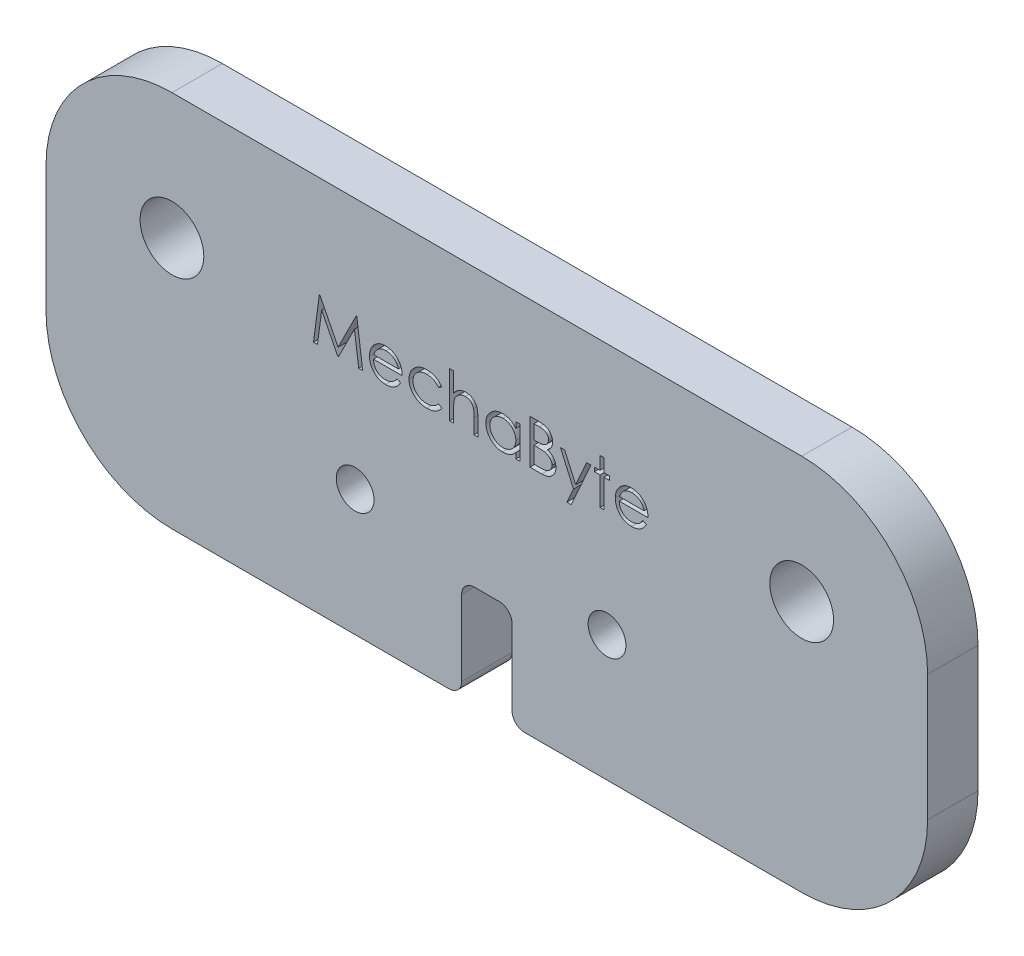
from build123d import *

# Parameters (mm, degrees)
SKETCH1_R           = 1.5
SKETCH1_R_2         = 2.53
BOSS_EXTRUDE1_DEPTH = 4
CUT_EXTRUDE1_DEPTH  = 77.26270386


with BuildPart() as part:
    # Sketch1 → Boss-Extrude1 (new body)
    with BuildSketch(Plane.XY):
        with BuildLine():
            Line((-37, 1), (-37, 7))
            ThreePointArc((-37, 7), (-36.707106781, 7.707106781), (-36, 8))
            Line((-36, 8), (-34, 8))
            ThreePointArc((-34, 8), (-33.292893219, 7.707106781), (-33, 7))
            Line((-33, 7), (-33, 1))
            ThreePointArc((-33, 1), (-32.707106781, 0.292893219), (-32, 0))
            Line((-32, 0), (-10, 0))
            ThreePointArc((-10, 0), (-2.928932188, 2.928932188), (0, 10))
            Line((0, 10), (0, 20))
            ThreePointArc((0, 20), (-2.928932188, 27.071067812), (-10, 30))
            Line((-10, 30), (-60, 30))
            ThreePointArc((-60, 30), (-67.071067812, 27.071067812), (-70, 20))
            Line((-70, 20), (-70, 10))
            ThreePointArc((-70, 10), (-67.071067812, 2.928932188), (-60, 0))
            Line((-60, 0), (-38, 0))
            ThreePointArc((-38, 0), (-37.292893219, 0.292893219), (-37, 1))
        make_face()
        with Locations((-25.456300864, 10)):
            Circle(SKETCH1_R, mode=Mode.SUBTRACT)
        with Locations((-45.456300864, 10)):
            Circle(SKETCH1_R, mode=Mode.SUBTRACT)
        with Locations((-10, 20)):
            Circle(SKETCH1_R_2, mode=Mode.SUBTRACT)
        with Locations((-60, 20)):
            Circle(SKETCH1_R_2, mode=Mode.SUBTRACT)
    extrude(amount=BOSS_EXTRUDE1_DEPTH)

    # Sketch2 → Cut-Extrude1 (cut, through all)
    # profile 1 of 9: a face of its own
    with BuildSketch(Plane.XY.offset(4)):
        Polygon((-48.761506491, 18.460965851), (-48.299467228, 21.960965851), (-48.254595433, 21.960965851), (-46.809583414, 19.089170979), (-45.368778125, 21.960965851), (-45.323906331, 21.960965851), (-44.857660337, 18.460965851), (-45.171762901, 18.460965851), (-45.508301363, 20.977291973), (-46.771021715, 18.460965851), (-46.842536138, 18.460965851), (-48.110865465, 20.985004312), (-48.445300561, 18.460965851), align=None)
    # profile 2 of 9: a face of its own
    with BuildSketch(Plane.XY.offset(4)):
        with BuildLine():
            Line((-42.130296555, 19.268658159), (-41.851250081, 19.122123703))
            add(Edge.make_bspline(
                [(-41.851250081, 19.122123703), (-41.873486676, 19.082680372), (-41.916750284, 19.005939269), (-41.991151032, 18.900507409), (-42.069143105, 18.805659693), (-42.154247073, 18.723930039), (-42.243916752, 18.652678654), (-42.338649406, 18.590340829), (-42.438938224, 18.537222309), (-42.544787949, 18.492469781), (-42.6570875, 18.458060287), (-42.776109017, 18.433756066), (-42.902080512, 18.418732797), (-42.988426692, 18.416987656), (-43.032640305, 18.416094056)],
                knots=[0, 0, 0, 0, 1.120438281, 2.179929193, 3.190490725, 4.156257408, 5.095198341, 6.022838206, 6.959905092, 7.901321166, 8.864066838, 9.862729781, 10.905609505, 12, 12, 12, 12], degree=3))
            add(Edge.make_bspline(
                [(-43.032640305, 18.416094056), (-43.081782282, 18.417241231), (-43.177644044, 18.419479038), (-43.317183791, 18.438771503), (-43.44856321, 18.470243861), (-43.571774913, 18.514209403), (-43.686517166, 18.571636727), (-43.79301802, 18.641596209), (-43.891837546, 18.723728463), (-43.979861755, 18.818744907), (-44.059105638, 18.920426864), (-44.129031458, 19.026382749), (-44.187488889, 19.136345973), (-44.235041499, 19.249616497), (-44.273446364, 19.365480391), (-44.300213068, 19.484991858), (-44.315642816, 19.607827442), (-44.318007262, 19.690924778), (-44.319198798, 19.732800787)],
                knots=[0, 0, 0, 0, 1.145258523, 2.234067595, 3.276747158, 4.290159414, 5.277019952, 6.260822364, 7.254936242, 8.264827045, 9.274100331, 10.257902744, 11.220704747, 12.172965371, 13.118907548, 14.062713208, 15.023725156, 16, 16, 16, 16], degree=3))
            add(Edge.make_bspline(
                [(-44.319198798, 19.732800787), (-44.318139657, 19.772095617), (-44.316040579, 19.849972782), (-44.302809791, 19.965238326), (-44.279361498, 20.077266779), (-44.247185174, 20.186151227), (-44.205633928, 20.291709361), (-44.154801709, 20.394005425), (-44.094609331, 20.492930564), (-44.048136658, 20.555333698), (-44.024727645, 20.586767133)],
                knots=[0, 0, 0, 0, 1.024358464, 2.0301432, 3.019427413, 4.004406732, 4.986367066, 5.972626655, 6.978780325, 8, 8, 8, 8], degree=3))
            add(Edge.make_bspline(
                [(-44.024727645, 20.586767133), (-43.993019962, 20.624636003), (-43.930609015, 20.699174154), (-43.82505266, 20.797112479), (-43.710752464, 20.879156254), (-43.589140837, 20.947163391), (-43.458804363, 20.998837038), (-43.321495072, 21.03734462), (-43.175649486, 21.058922631), (-43.075944265, 21.061970465), (-43.024927965, 21.063529953)],
                knots=[0, 0, 0, 0, 1.030682036, 2.02871468, 2.997146059, 3.962720338, 4.930598197, 5.918074684, 6.934738563, 8, 8, 8, 8], degree=3))
            add(Edge.make_bspline(
                [(-43.024927965, 21.063529953), (-42.97248036, 21.062175905), (-42.869590114, 21.059519569), (-42.719557993, 21.034893236), (-42.577597276, 20.995840681), (-42.443764772, 20.940686891), (-42.318046911, 20.869527339), (-42.201260862, 20.781385498), (-42.091409349, 20.67896741), (-42.02750077, 20.600204201), (-41.994980048, 20.560124505)],
                knots=[0, 0, 0, 0, 1.056321875, 2.072262726, 3.055038591, 4.01806755, 4.982017516, 5.957941055, 6.960871419, 8, 8, 8, 8], degree=3))
            add(Edge.make_bspline(
                [(-41.994980048, 20.560124505), (-41.97285311, 20.529920923), (-41.928746517, 20.469714805), (-41.873499417, 20.371543648), (-41.825542022, 20.268833053), (-41.787209061, 20.159922756), (-41.75616956, 20.046103176), (-41.733712741, 19.926560631), (-41.720543123, 19.80133072), (-41.717954425, 19.716004164), (-41.716634696, 19.672504312)],
                knots=[0, 0, 0, 0, 0.94817472, 1.890038105, 2.849395472, 3.817997239, 4.812318967, 5.836947057, 6.897266129, 8, 8, 8, 8], degree=3))
            Line((-41.716634696, 19.672504312), (-44.005096234, 19.672504312))
            add(Edge.make_bspline(
                [(-44.005096234, 19.672504312), (-44.003556628, 19.638803848), (-44.000529054, 19.572533244), (-43.986413911, 19.475562461), (-43.964165137, 19.383189119), (-43.932896074, 19.296106077), (-43.895029229, 19.21317595), (-43.848643512, 19.135013913), (-43.793303958, 19.061975983), (-43.731578259, 18.993408845), (-43.662871164, 18.932348084), (-43.590588416, 18.877696308), (-43.513694851, 18.831890711), (-43.432796768, 18.794710821), (-43.348024983, 18.765604505), (-43.259352788, 18.745736685), (-43.166954671, 18.732429578), (-43.103968937, 18.730949912), (-43.071903125, 18.73019662)],
                knots=[0, 0, 0, 0, 1.094153842, 2.151609401, 3.174256925, 4.172055639, 5.149267565, 6.128595816, 7.11444997, 8.118368179, 9.117203808, 10.09244225, 11.054858984, 12.015122123, 12.976791628, 13.957293641, 14.960065497, 16, 16, 16, 16], degree=3))
            add(Edge.make_bspline(
                [(-43.071903125, 18.73019662), (-43.040551978, 18.730804677), (-42.978345287, 18.732011178), (-42.88570443, 18.743743089), (-42.794564902, 18.762713364), (-42.705303919, 18.788603354), (-42.619733073, 18.820180207), (-42.540487523, 18.858283064), (-42.467607307, 18.900432811), (-42.399490341, 18.948642486), (-42.333419347, 19.007650673), (-42.267876861, 19.081286394), (-42.197600208, 19.168373922), (-42.153610615, 19.233919588), (-42.130296555, 19.268658159)],
                knots=[0, 0, 0, 0, 0.99110716, 1.966546729, 2.947904876, 3.932708344, 4.903319531, 5.828989031, 6.710028674, 7.56322171, 8.463672341, 9.504779593, 10.677557249, 12, 12, 12, 12], degree=3))
        make_face()
        with BuildLine():
            add(Edge.make_bspline(
                [(-42.03073726, 19.986606877), (-42.042233885, 20.02826975), (-42.064361186, 20.108457371), (-42.11059755, 20.219498261), (-42.162669091, 20.318186162), (-42.224290823, 20.403765795), (-42.294109548, 20.479769308), (-42.374754731, 20.546187894), (-42.465190624, 20.605605345), (-42.564949765, 20.655757844), (-42.67059155, 20.698447703), (-42.781197742, 20.727072819), (-42.89405553, 20.746682361), (-42.970389816, 20.748508469), (-43.008802164, 20.749427389)],
                knots=[0, 0, 0, 0, 1.154881502, 2.222775134, 3.210006277, 4.132804581, 5.035138423, 5.962687519, 6.919655026, 7.923214229, 8.944639381, 9.960483929, 10.97369054, 12, 12, 12, 12], degree=3))
            add(Edge.make_bspline(
                [(-43.008802164, 20.749427389), (-43.040151602, 20.748815718), (-43.102122851, 20.747606572), (-43.19342392, 20.736136442), (-43.281103619, 20.717176598), (-43.365808906, 20.691211641), (-43.446429775, 20.656603038), (-43.524624543, 20.616019812), (-43.598404939, 20.566478228), (-43.644546234, 20.528719373), (-43.667856651, 20.509643736)],
                knots=[0, 0, 0, 0, 1.04873581, 2.073130211, 3.073294108, 4.04793562, 5.032784715, 6.005352987, 6.992311501, 8, 8, 8, 8], degree=3))
            add(Edge.make_bspline(
                [(-43.667856651, 20.509643736), (-43.684549933, 20.49454942), (-43.718333067, 20.464002204), (-43.763473589, 20.411372997), (-43.806694061, 20.354621435), (-43.846027714, 20.291576311), (-43.882105301, 20.222955532), (-43.915865278, 20.149337896), (-43.94625169, 20.070164766), (-43.9633478, 20.014992327), (-43.97214351, 19.986606877)],
                knots=[0, 0, 0, 0, 0.879870761, 1.780643979, 2.707998968, 3.669668524, 4.684282772, 5.740141944, 6.837334558, 8, 8, 8, 8], degree=3))
            Line((-43.97214351, 19.986606877), (-42.03073726, 19.986606877))
        make_face(mode=Mode.SUBTRACT)
    # profile 3 of 9: a face of its own
    with BuildSketch(Plane.XY.offset(4)):
        with BuildLine():
            Line((-38.575609055, 20.464070819), (-38.838529728, 20.300709441))
            add(Edge.make_bspline(
                [(-38.838529728, 20.300709441), (-38.867359593, 20.336537835), (-38.924106289, 20.407059945), (-39.022645525, 20.498069878), (-39.127656939, 20.57623692), (-39.240934987, 20.639940671), (-39.362320787, 20.689162121), (-39.491335638, 20.723992327), (-39.627961143, 20.74569657), (-39.721626342, 20.748163406), (-39.769619472, 20.749427389)],
                knots=[0, 0, 0, 0, 1.026593902, 2.0206758, 2.988051866, 3.946915611, 4.916868779, 5.907761954, 6.927957743, 8, 8, 8, 8], degree=3))
            add(Edge.make_bspline(
                [(-39.769619472, 20.749427389), (-39.807978428, 20.748370547), (-39.883525351, 20.746289125), (-39.994431505, 20.733278632), (-40.100073858, 20.709636624), (-40.201114567, 20.678485667), (-40.296834985, 20.636735377), (-40.387485904, 20.585925621), (-40.473871394, 20.52687558), (-40.553488135, 20.458465035), (-40.626317142, 20.384066367), (-40.689416056, 20.304312672), (-40.744352989, 20.221592781), (-40.787458946, 20.133841039), (-40.822734116, 20.043064985), (-40.845940836, 19.94755113), (-40.861405532, 19.848523122), (-40.86317486, 19.781004782), (-40.864070593, 19.746823223)],
                knots=[0, 0, 0, 0, 1.112346261, 2.190735716, 3.231507886, 4.247384806, 5.251966152, 6.253067467, 7.256802811, 8.280671706, 9.291813951, 10.270744147, 11.225547591, 12.165006084, 13.100104208, 14.043489273, 15.009504848, 16, 16, 16, 16], degree=3))
            add(Edge.make_bspline(
                [(-40.864070593, 19.746823223), (-40.862291341, 19.702054012), (-40.858756811, 19.613118816), (-40.831055351, 19.481840714), (-40.785710944, 19.354917024), (-40.723653093, 19.233248887), (-40.645175959, 19.120654731), (-40.553003395, 19.019671277), (-40.447084312, 18.932255249), (-40.328351981, 18.859782724), (-40.199594238, 18.801521356), (-40.062204133, 18.760014023), (-39.917304353, 18.734961651), (-39.818097605, 18.731805708), (-39.767516106, 18.73019662)],
                knots=[0, 0, 0, 0, 0.966302908, 1.919585723, 2.883856336, 3.870342332, 4.860282998, 5.839159637, 6.814385684, 7.815993281, 8.834850808, 9.858348828, 10.908058873, 12, 12, 12, 12], degree=3))
            add(Edge.make_bspline(
                [(-39.767516106, 18.73019662), (-39.721160922, 18.731496117), (-39.630060683, 18.734049974), (-39.496893398, 18.755578938), (-39.370113487, 18.790822571), (-39.249725457, 18.839970221), (-39.135949291, 18.903497737), (-39.029520116, 18.981856908), (-38.928320178, 19.072793508), (-38.868823201, 19.14311148), (-38.838529728, 19.178914569)],
                knots=[0, 0, 0, 0, 1.039848629, 2.043578496, 3.018386758, 3.987534228, 4.954977003, 5.934852016, 6.948509513, 8, 8, 8, 8], degree=3))
            Line((-38.838529728, 19.178914569), (-38.575609055, 19.006438607))
            add(Edge.make_bspline(
                [(-38.575609055, 19.006438607), (-38.591196757, 18.98354788), (-38.622320424, 18.937842404), (-38.674348049, 18.873398287), (-38.730467881, 18.813076605), (-38.790460978, 18.756958215), (-38.853543988, 18.703700195), (-38.921871897, 18.655848621), (-38.993241509, 18.610713798), (-39.068490667, 18.570100926), (-39.146841365, 18.533594605), (-39.228183354, 18.502203434), (-39.312163167, 18.475233328), (-39.398879543, 18.453795981), (-39.488503441, 18.436685143), (-39.580803076, 18.425331441), (-39.675746657, 18.41685616), (-39.739918809, 18.416350293), (-39.772423959, 18.416094056)],
                knots=[0, 0, 0, 0, 0.954134338, 1.905101784, 2.851144739, 3.791306361, 4.734911809, 5.6936923, 6.663572882, 7.643865596, 8.638447847, 9.640600242, 10.646758161, 11.676244097, 12.717260333, 13.78922464, 14.880174919, 16, 16, 16, 16], degree=3))
            add(Edge.make_bspline(
                [(-39.772423959, 18.416094056), (-39.822034842, 18.416985336), (-39.919272535, 18.418732251), (-40.061595042, 18.437940726), (-40.197608709, 18.466898342), (-40.327267067, 18.508462076), (-40.450590302, 18.561966852), (-40.56746342, 18.627323766), (-40.677499438, 18.705075556), (-40.779610221, 18.793838325), (-40.873391667, 18.890078966), (-40.953917857, 18.993928884), (-41.023763128, 19.101569932), (-41.079850671, 19.215379458), (-41.124497597, 19.333844831), (-41.15500243, 19.457915071), (-41.174732168, 19.586567325), (-41.177015547, 19.674300207), (-41.178173157, 19.718778351)],
                knots=[0, 0, 0, 0, 1.1129367, 2.181364009, 3.217532258, 4.231199276, 5.232079859, 6.230262199, 7.231623845, 8.250719726, 9.263571943, 10.242672461, 11.195837495, 12.138959767, 13.085126421, 14.0317438, 15.002148558, 16, 16, 16, 16], degree=3))
            add(Edge.make_bspline(
                [(-41.178173157, 19.718778351), (-41.177732141, 19.748956785), (-41.176854887, 19.808986673), (-41.16679296, 19.89808174), (-41.153794487, 19.985990285), (-41.13176875, 20.071598004), (-41.106328118, 20.156203294), (-41.073852586, 20.238786396), (-41.035757191, 20.319731068), (-40.992505244, 20.398828798), (-40.943816499, 20.474778337), (-40.889935266, 20.546532002), (-40.832890929, 20.614951768), (-40.770014817, 20.677675528), (-40.703975164, 20.73721172), (-40.632903588, 20.791969844), (-40.557207736, 20.842110835), (-40.478024414, 20.88856185), (-40.395399702, 20.929921285), (-40.309833032, 20.965554523), (-40.221840003, 20.996007099), (-40.131279859, 21.020116018), (-40.038753685, 21.040333442), (-39.943532347, 21.053051288), (-39.845980125, 21.062037561), (-39.779924102, 21.063028353), (-39.746482452, 21.063529953)],
                knots=[0, 0, 0, 0, 0.990994727, 1.971252077, 2.943264845, 3.907940874, 4.872158414, 5.844625996, 6.82015047, 7.809835459, 8.804511986, 9.781214284, 10.756496977, 11.728388426, 12.696359165, 13.676225489, 14.672885716, 15.677705647, 16.690706858, 17.706033469, 18.721040654, 19.747369689, 20.783475414, 21.830280724, 22.901553713, 24, 24, 24, 24], degree=3))
            add(Edge.make_bspline(
                [(-39.746482452, 21.063529953), (-39.704602344, 21.062608062), (-39.621051465, 21.060768888), (-39.497110758, 21.045290236), (-39.374995564, 21.02195382), (-39.256848461, 20.98738099), (-39.144101946, 20.945517334), (-39.038566496, 20.89850462), (-38.942726392, 20.843910016), (-38.854798803, 20.784189902), (-38.774619286, 20.716828996), (-38.701364793, 20.641022039), (-38.633533144, 20.55716356), (-38.595076432, 20.495357829), (-38.575609055, 20.464070819)],
                knots=[0, 0, 0, 0, 1.095225653, 2.184976855, 3.262915854, 4.344593502, 5.400796181, 6.407717688, 7.363229445, 8.282371371, 9.184954523, 10.097238608, 11.036792983, 12, 12, 12, 12], degree=3))
        make_face()
    # profile 4 of 9: a face of its own
    with BuildSketch(Plane.XY.offset(4)):
        with BuildLine():
            Line((-37.947403927, 22.050709441), (-37.633301363, 22.050709441))
            Line((-37.633301363, 22.050709441), (-37.633301363, 20.535585242))
            add(Edge.make_bspline(
                [(-37.633301363, 20.535585242), (-37.599584061, 20.577729224), (-37.533934747, 20.659785717), (-37.42343863, 20.766846908), (-37.309967758, 20.859645529), (-37.189602948, 20.933515986), (-37.064552428, 20.991872529), (-36.934288784, 21.033260176), (-36.798787812, 21.058711272), (-36.706762662, 21.06190969), (-36.660144311, 21.063529953)],
                knots=[0, 0, 0, 0, 1.125788106, 2.19196713, 3.20547328, 4.180437432, 5.132270164, 6.079753143, 7.027236121, 8, 8, 8, 8], degree=3))
            add(Edge.make_bspline(
                [(-36.660144311, 21.063529953), (-36.612813918, 21.061784523), (-36.520176923, 21.058368295), (-36.38529546, 21.031354914), (-36.259334585, 20.985197476), (-36.142668743, 20.922030451), (-36.037844045, 20.843357624), (-35.944994281, 20.752526101), (-35.869153482, 20.647252183), (-35.817554365, 20.549995929), (-35.783980958, 20.463457175), (-35.762729131, 20.389220663), (-35.744709933, 20.30649875), (-35.729010197, 20.215334017), (-35.718546616, 20.115288846), (-35.710141998, 20.006814591), (-35.704165543, 19.889917473), (-35.703933939, 19.808997224), (-35.703814183, 19.767155755)],
                knots=[0, 0, 0, 0, 1.235656852, 2.418478516, 3.575258207, 4.727955599, 5.870717718, 6.98870536, 8.107142894, 9.245821548, 9.854588956, 10.528768408, 11.260415777, 12.065282286, 12.943670737, 13.886611085, 14.907229059, 16, 16, 16, 16], degree=3))
            Line((-35.703814183, 19.767155755), (-35.703814183, 18.460965851))
            Line((-35.703814183, 18.460965851), (-36.017916747, 18.460965851))
            Line((-36.017916747, 18.460965851), (-36.017916747, 19.664090851))
            add(Edge.make_bspline(
                [(-36.017916747, 19.664090851), (-36.01810705, 19.69891352), (-36.018471068, 19.765523361), (-36.019674412, 19.860889469), (-36.022360628, 19.947385604), (-36.026701454, 20.024734556), (-36.031266761, 20.093044159), (-36.037550078, 20.152215213), (-36.044860312, 20.202328989), (-36.051429094, 20.232493617), (-36.054375081, 20.246021941)],
                knots=[0, 0, 0, 0, 1.430932559, 2.737130458, 3.918967929, 4.986496826, 5.920444988, 6.731744033, 7.431208747, 8, 8, 8, 8], degree=3))
            add(Edge.make_bspline(
                [(-36.054375081, 20.246021941), (-36.065799326, 20.285716204), (-36.08776237, 20.362028195), (-36.138810347, 20.465690605), (-36.202569359, 20.554075346), (-36.28041662, 20.625989634), (-36.370974984, 20.682401173), (-36.474834948, 20.721468956), (-36.591019017, 20.745716677), (-36.672870489, 20.748155981), (-36.715532933, 20.749427389)],
                knots=[0, 0, 0, 0, 1.090059168, 2.095632401, 3.037101401, 3.955032261, 4.878929692, 5.839099886, 6.873700383, 8, 8, 8, 8], degree=3))
            add(Edge.make_bspline(
                [(-36.715532933, 20.749427389), (-36.740800706, 20.748951563), (-36.790804977, 20.748009915), (-36.864953642, 20.738556017), (-36.936882706, 20.723107298), (-37.007284884, 20.702202759), (-37.074668081, 20.673757223), (-37.140996406, 20.640827033), (-37.204390615, 20.600518778), (-37.265976432, 20.555293011), (-37.323293966, 20.505223251), (-37.376621081, 20.452376296), (-37.424159421, 20.396101332), (-37.467228012, 20.337301216), (-37.504406298, 20.275169423), (-37.53685938, 20.210305104), (-37.564395076, 20.142622958), (-37.578077769, 20.095647897), (-37.584923959, 20.072143736)],
                knots=[0, 0, 0, 0, 1.024319606, 2.027102035, 3.025350316, 4.005802111, 5.00026367, 5.987881639, 7.005602596, 8.042517216, 9.083927026, 10.089214625, 11.084353441, 12.06828073, 13.041928858, 14.016821737, 15.00770877, 16, 16, 16, 16], degree=3))
            add(Edge.make_bspline(
                [(-37.584923959, 20.072143736), (-37.588863386, 20.055122785), (-37.597447883, 20.018032038), (-37.606762716, 19.956857714), (-37.615100513, 19.885771342), (-37.622149062, 19.804880741), (-37.626472149, 19.713889499), (-37.63113039, 19.61341854), (-37.632864404, 19.502838519), (-37.633151357, 19.425943012), (-37.633301363, 19.385745498)],
                knots=[0, 0, 0, 0, 0.607992626, 1.324890765, 2.152360218, 3.099583803, 4.150613268, 5.323148443, 6.60066238, 8, 8, 8, 8], degree=3))
            Line((-37.633301363, 19.385745498), (-37.633301363, 18.460965851))
            Line((-37.633301363, 18.460965851), (-37.947403927, 18.460965851))
            Line((-37.947403927, 18.460965851), (-37.947403927, 22.050709441))
        make_face()
    # profile 5 of 9: a face of its own
    with BuildSketch(Plane.XY.offset(4)):
        with BuildLine():
            Line((-32.383301363, 21.018658159), (-32.383301363, 18.460965851))
            Line((-32.383301363, 18.460965851), (-32.697403927, 18.460965851))
            Line((-32.697403927, 18.460965851), (-32.697403927, 18.903373703))
            add(Edge.make_bspline(
                [(-32.697403927, 18.903373703), (-32.732822717, 18.86333411), (-32.801942933, 18.785196338), (-32.917384051, 18.683114166), (-33.039752228, 18.598735844), (-33.16845355, 18.530585929), (-33.303371793, 18.479393872), (-33.44420788, 18.443007713), (-33.591019261, 18.419613878), (-33.691271616, 18.417277856), (-33.742075401, 18.416094056)],
                knots=[0, 0, 0, 0, 1.074387032, 2.096679803, 3.090159297, 4.057316773, 5.018401886, 5.985159533, 6.978961417, 8, 8, 8, 8], degree=3))
            add(Edge.make_bspline(
                [(-33.742075401, 18.416094056), (-33.787243355, 18.417320428), (-33.87631656, 18.419738889), (-34.007345637, 18.438501192), (-34.133437886, 18.468631814), (-34.254712459, 18.510532704), (-34.370384604, 18.566113525), (-34.481444701, 18.632654773), (-34.587317393, 18.711895603), (-34.686388932, 18.802483632), (-34.777620932, 18.900878619), (-34.857682205, 19.005824166), (-34.924435285, 19.11686647), (-34.980255366, 19.232599623), (-35.02325171, 19.353914543), (-35.053225344, 19.480391711), (-35.071965791, 19.611881584), (-35.074383252, 19.701421108), (-35.075609055, 19.746823223)],
                knots=[0, 0, 0, 0, 1.033919861, 2.038935746, 3.024066025, 3.998881131, 4.97069526, 5.957263378, 6.95902576, 7.993208707, 9.027059324, 10.027763471, 11.009749337, 11.988697705, 12.965288445, 13.950418724, 14.960734635, 16, 16, 16, 16], degree=3))
            add(Edge.make_bspline(
                [(-35.075609055, 19.746823223), (-35.074356083, 19.791286926), (-35.071879027, 19.87918927), (-35.053425807, 20.008467968), (-35.022394798, 20.132986228), (-34.97884695, 20.252343172), (-34.923004996, 20.366683222), (-34.855076909, 20.476087247), (-34.775057784, 20.580856644), (-34.682805377, 20.678527871), (-34.582870607, 20.768748485), (-34.475961876, 20.847157531), (-34.364738594, 20.91487438), (-34.247475584, 20.968527856), (-34.125908479, 21.01193696), (-33.998955033, 21.041969928), (-33.867143455, 21.05966725), (-33.777652963, 21.062230014), (-33.732259696, 21.063529953)],
                knots=[0, 0, 0, 0, 1.020392517, 2.01726096, 2.990465484, 3.961182959, 4.928053699, 5.906110375, 6.912531644, 7.948652711, 8.985773172, 9.998621852, 10.987621588, 11.969261332, 12.953316658, 13.946091881, 14.958173133, 16, 16, 16, 16], degree=3))
            add(Edge.make_bspline(
                [(-33.732259696, 21.063529953), (-33.680059837, 21.062092202), (-33.577698377, 21.059272839), (-33.427970368, 21.035810112), (-33.28632589, 20.996171645), (-33.151671538, 20.942254147), (-33.024490852, 20.870605417), (-32.905987867, 20.780225456), (-32.794922384, 20.671684269), (-32.730542092, 20.588313825), (-32.697403927, 20.545400947)],
                knots=[0, 0, 0, 0, 1.038897134, 2.037228247, 3.008116434, 3.962042015, 4.918381754, 5.904844433, 6.921570401, 8, 8, 8, 8], degree=3))
            Line((-32.697403927, 20.545400947), (-32.697403927, 21.018658159))
            Line((-32.697403927, 21.018658159), (-32.383301363, 21.018658159))
        make_face()
        with BuildLine():
            add(Edge.make_bspline(
                [(-33.728052965, 20.749427389), (-33.773967303, 20.747793752), (-33.864594903, 20.744569211), (-33.997638905, 20.719395715), (-34.124952319, 20.677511121), (-34.245898393, 20.62022922), (-34.35856661, 20.548200483), (-34.459260281, 20.4610791), (-34.548802982, 20.361242086), (-34.624111246, 20.249139975), (-34.685501743, 20.128961884), (-34.728668775, 20.003337446), (-34.757138023, 19.874532469), (-34.760046543, 19.787169783), (-34.761506491, 19.743317614)],
                knots=[0, 0, 0, 0, 1.031046209, 2.035121221, 3.029706178, 4.034933723, 5.034054252, 6.02443088, 7.017295772, 8.038157696, 9.050218397, 10.03989886, 11.016116709, 12, 12, 12, 12], degree=3))
            add(Edge.make_bspline(
                [(-34.761506491, 19.743317614), (-34.759641597, 19.699727507), (-34.755919121, 19.612718151), (-34.729168426, 19.483737574), (-34.684288553, 19.358083532), (-34.62304649, 19.236822538), (-34.546359865, 19.124238438), (-34.457471213, 19.022498315), (-34.355520931, 18.935008727), (-34.242593424, 18.861771154), (-34.121985454, 18.802608633), (-33.995151523, 18.761442993), (-33.864475884, 18.734865213), (-33.77562355, 18.731760736), (-33.730857452, 18.73019662)],
                knots=[0, 0, 0, 0, 0.979072187, 1.954306742, 2.945804271, 3.96968567, 4.997920485, 5.998718438, 6.996577872, 8.005894225, 9.015743152, 10.005417472, 10.995077863, 12, 12, 12, 12], degree=3))
            add(Edge.make_bspline(
                [(-33.730857452, 18.73019662), (-33.68541095, 18.731856584), (-33.595022363, 18.735158088), (-33.461583655, 18.760439353), (-33.332088692, 18.802208151), (-33.208301464, 18.860107278), (-33.092985333, 18.931864634), (-32.989487455, 19.015871725), (-32.901971487, 19.113574909), (-32.827778877, 19.220951362), (-32.769603461, 19.338663359), (-32.727227401, 19.463997549), (-32.702173496, 19.596958298), (-32.699015766, 19.687822224), (-32.697403927, 19.73420303)],
                knots=[0, 0, 0, 0, 1.01762866, 2.023962475, 3.030623092, 4.058876274, 5.077231937, 6.066672613, 7.034107872, 8.005628644, 8.981990164, 9.965428785, 10.961468474, 12, 12, 12, 12], degree=3))
            add(Edge.make_bspline(
                [(-32.697403927, 19.73420303), (-32.698363583, 19.769540861), (-32.70025249, 19.839096894), (-32.71468306, 19.941224412), (-32.737637986, 20.038958138), (-32.769984156, 20.132400827), (-32.812475441, 20.221035842), (-32.863723207, 20.305499603), (-32.924628656, 20.385352814), (-32.994211353, 20.459495885), (-33.070376555, 20.527122347), (-33.150971096, 20.587486588), (-33.236949843, 20.637075361), (-33.32686688, 20.678116632), (-33.420878214, 20.710775782), (-33.519748834, 20.732563476), (-33.622427821, 20.747523797), (-33.692473876, 20.748786178), (-33.728052965, 20.749427389)],
                knots=[0, 0, 0, 0, 1.050140795, 2.067009409, 3.05949893, 4.030605086, 5.00011959, 5.97591094, 6.962425594, 7.979863591, 8.993523472, 9.986985069, 10.967611495, 11.937549037, 12.921786183, 13.919465291, 14.943216303, 16, 16, 16, 16], degree=3))
        make_face(mode=Mode.SUBTRACT)
    # profile 6 of 9: a face of its own
    with BuildSketch(Plane.XY.offset(4)):
        with BuildLine():
            Line((-31.575609055, 21.960965851), (-30.892716427, 21.960965851))
            add(Edge.make_bspline(
                [(-30.892716427, 21.960965851), (-30.859287948, 21.960790101), (-30.794495238, 21.960449453), (-30.700275796, 21.955166321), (-30.612026986, 21.947962651), (-30.529723213, 21.936532559), (-30.453402511, 21.922740782), (-30.382834874, 21.906038966), (-30.318244701, 21.886012352), (-30.241131965, 21.854166071), (-30.153211304, 21.806842902), (-30.058012911, 21.736914337), (-29.976608672, 21.651381874), (-29.906422355, 21.554899219), (-29.850621235, 21.448763447), (-29.810251938, 21.335504258), (-29.784694063, 21.216582516), (-29.782065628, 21.134939338), (-29.78073726, 21.093678191)],
                knots=[0, 0, 0, 0, 1.001505555, 1.941167018, 2.826882275, 3.653841531, 4.429895133, 5.150066043, 5.825578002, 6.45369114, 7.647487171, 8.808567382, 9.977351308, 11.170798116, 12.373658725, 13.556498008, 14.765093433, 16, 16, 16, 16], degree=3))
            add(Edge.make_bspline(
                [(-29.78073726, 21.093678191), (-29.781830478, 21.055025635), (-29.783978756, 20.979069718), (-29.804521515, 20.867975609), (-29.836682184, 20.76222439), (-29.881387433, 20.662202004), (-29.939489429, 20.570168391), (-30.008347748, 20.485381125), (-30.09142455, 20.411430068), (-30.15366779, 20.370087166), (-30.185284536, 20.349086845)],
                knots=[0, 0, 0, 0, 1.044552857, 2.05264487, 3.044412934, 4.028983338, 5.005914585, 5.980388656, 6.974128949, 8, 8, 8, 8], degree=3))
            add(Edge.make_bspline(
                [(-30.185284536, 20.349086845), (-30.145524108, 20.333821846), (-30.069452561, 20.304616121), (-29.964766548, 20.252980657), (-29.874571703, 20.196818547), (-29.798174557, 20.135486697), (-29.732836902, 20.069377886), (-29.675783961, 19.997522772), (-29.627102587, 19.918984014), (-29.585389663, 19.834580478), (-29.552840907, 19.74517401), (-29.528465003, 19.651603234), (-29.514497554, 19.554203679), (-29.512509912, 19.487918299), (-29.511506491, 19.454455434)],
                knots=[0, 0, 0, 0, 1.27268992, 2.434971085, 3.483601985, 4.442670788, 5.356604649, 6.2567628, 7.179492994, 8.113709626, 9.066344395, 10.018646069, 10.999752585, 12, 12, 12, 12], degree=3))
            add(Edge.make_bspline(
                [(-29.511506491, 19.454455434), (-29.512483337, 19.420288562), (-29.514405309, 19.353064284), (-29.528585281, 19.254309149), (-29.552594388, 19.159934203), (-29.585665534, 19.06932902), (-29.628827848, 18.982668886), (-29.681355813, 18.899855622), (-29.743987376, 18.821721291), (-29.814050245, 18.747397668), (-29.893312391, 18.680569881), (-29.978828146, 18.621054174), (-30.071674466, 18.572108112), (-30.17032646, 18.53099209), (-30.275890776, 18.499584892), (-30.387893383, 18.477612318), (-30.506237685, 18.462807281), (-30.587447436, 18.461590076), (-30.629094632, 18.460965851)],
                knots=[0, 0, 0, 0, 0.978564426, 1.925352924, 2.850884081, 3.763762016, 4.682927383, 5.618979971, 6.567305752, 7.547517671, 8.540179244, 9.531824382, 10.526200242, 11.540722885, 12.589160233, 13.674978461, 14.80764778, 16, 16, 16, 16], degree=3))
            Line((-30.629094632, 18.460965851), (-31.575609055, 18.460965851))
            Line((-31.575609055, 18.460965851), (-31.575609055, 21.960965851))
        make_face()
        with BuildLine():
            Line((-31.261506491, 21.601991492), (-31.261506491, 20.48019662))
            Line((-31.261506491, 20.48019662), (-31.050468831, 20.48019662))
            add(Edge.make_bspline(
                [(-31.050468831, 20.48019662), (-31.019620035, 20.480596543), (-30.960013876, 20.481369276), (-30.873693979, 20.483582793), (-30.793568961, 20.489780836), (-30.719777128, 20.495977098), (-30.652434684, 20.506051686), (-30.591690823, 20.518043809), (-30.536592226, 20.530726714), (-30.47305268, 20.552296201), (-30.400979732, 20.584173876), (-30.324146628, 20.633645712), (-30.256412158, 20.692570066), (-30.19921497, 20.760561027), (-30.1524035, 20.835427213), (-30.119889785, 20.915974094), (-30.0978425, 21.000194226), (-30.095850969, 21.058012478), (-30.094839824, 21.087368095)],
                knots=[0, 0, 0, 0, 1.156816544, 2.235205308, 3.236616184, 4.169592532, 5.011045266, 5.787822928, 6.49130361, 7.128639758, 8.301311294, 9.436451833, 10.541879658, 11.654887649, 12.756523258, 13.837046038, 14.901820046, 16, 16, 16, 16], degree=3))
            add(Edge.make_bspline(
                [(-30.094839824, 21.087368095), (-30.095366004, 21.106793866), (-30.096398164, 21.144899638), (-30.104851467, 21.200448992), (-30.119219041, 21.252692745), (-30.137673334, 21.302346855), (-30.163462023, 21.347858705), (-30.193825486, 21.390801901), (-30.230511177, 21.42971402), (-30.272268489, 21.466083518), (-30.320277112, 21.498328046), (-30.374508404, 21.526568809), (-30.435696081, 21.549309586), (-30.502808936, 21.569225738), (-30.576880024, 21.583214032), (-30.657054577, 21.594867419), (-30.743989296, 21.600800161), (-30.804134399, 21.601585524), (-30.835224439, 21.601991492)],
                knots=[0, 0, 0, 0, 0.91205012, 1.789085906, 2.630437955, 3.453916878, 4.269457761, 5.079663411, 5.91843418, 6.774407191, 7.675494373, 8.627863946, 9.638891023, 10.736472738, 11.911756761, 13.175263542, 14.539845004, 16, 16, 16, 16], degree=3))
            Line((-30.835224439, 21.601991492), (-31.261506491, 21.601991492))
        make_face(mode=Mode.SUBTRACT)
        with BuildLine():
            Line((-31.261506491, 20.121222261), (-31.261506491, 18.81994021))
            Line((-31.261506491, 18.81994021), (-30.814190786, 18.81994021))
            add(Edge.make_bspline(
                [(-30.814190786, 18.81994021), (-30.78217186, 18.820323957), (-30.720459601, 18.82106358), (-30.631358371, 18.823478134), (-30.548775267, 18.82897041), (-30.473087132, 18.83761626), (-30.403476679, 18.846994709), (-30.340778976, 18.85960599), (-30.284485782, 18.87405495), (-30.219211475, 18.896389123), (-30.145707966, 18.931085594), (-30.06649711, 18.98339982), (-29.996070892, 19.045723128), (-29.936265633, 19.117854042), (-29.887252644, 19.196285369), (-29.851597189, 19.279430719), (-29.829606332, 19.365916246), (-29.826944163, 19.424882959), (-29.825609055, 19.454455434)],
                knots=[0, 0, 0, 0, 1.160039823, 2.235823828, 3.228722157, 4.157150951, 4.99529583, 5.772374946, 6.472645482, 7.099169577, 8.269452708, 9.405989375, 10.527446681, 11.663510218, 12.788923519, 13.866172445, 14.929861265, 16, 16, 16, 16], degree=3))
            add(Edge.make_bspline(
                [(-29.825609055, 19.454455434), (-29.825885159, 19.472948775), (-29.826432914, 19.509637157), (-29.834693529, 19.563552976), (-29.846707399, 19.615778849), (-29.862238833, 19.66645659), (-29.8848583, 19.714669966), (-29.911264845, 19.761372525), (-29.942226247, 19.806626005), (-29.990470413, 19.863838258), (-30.060642397, 19.929755271), (-30.160349172, 19.994292773), (-30.27372147, 20.046340581), (-30.355948963, 20.068440057), (-30.398425561, 20.079856075)],
                knots=[0, 0, 0, 0, 0.723448775, 1.435228256, 2.130040452, 2.821711965, 3.505591119, 4.210454504, 4.921174351, 5.648778258, 7.137944449, 8.670945889, 10.280296675, 12, 12, 12, 12], degree=3))
            add(Edge.make_bspline(
                [(-30.398425561, 20.079856075), (-30.415454657, 20.083311159), (-30.452377249, 20.090802494), (-30.51258483, 20.098710197), (-30.581320699, 20.105755257), (-30.658743576, 20.110966415), (-30.744951417, 20.116352958), (-30.840128336, 20.11844778), (-30.943885651, 20.12094704), (-31.015878023, 20.121128174), (-31.053273318, 20.121222261)],
                knots=[0, 0, 0, 0, 0.634451884, 1.375622551, 2.216452059, 3.157844607, 4.20941857, 5.370758133, 6.634282058, 8, 8, 8, 8], degree=3))
            Line((-31.053273318, 20.121222261), (-31.261506491, 20.121222261))
        make_face(mode=Mode.SUBTRACT)
    # profile 7 of 9: a face of its own
    with BuildSketch(Plane.XY.offset(4)):
        Polygon((-29.152532132, 21.018658159), (-28.814591427, 21.018658159), (-27.947303766, 19.059723864), (-27.068798157, 21.018658159), (-26.729455209, 21.018658159), (-28.299968029, 17.518658159), (-28.639310978, 17.518658159), (-28.116975241, 18.680416973), align=None)
    # profile 8 of 9: a face of its own
    with BuildSketch(Plane.XY.offset(4)):
        Polygon((-26.011506491, 22.050709441), (-25.697403927, 22.050709441), (-25.697403927, 21.018658159), (-25.248685978, 21.018658159), (-25.248685978, 20.704555595), (-25.697403927, 20.704555595), (-25.697403927, 18.460965851), (-26.011506491, 18.460965851), (-26.011506491, 20.704555595), (-26.460224439, 20.704555595), (-26.460224439, 21.018658159), (-26.011506491, 21.018658159), align=None)
    # profile 9 of 9: a face of its own
    with BuildSketch(Plane.XY.offset(4)):
        with BuildLine():
            Line((-22.611065786, 19.268658159), (-22.332019311, 19.122123703))
            add(Edge.make_bspline(
                [(-22.332019311, 19.122123703), (-22.354255907, 19.082680372), (-22.397519515, 19.005939269), (-22.471920263, 18.900507409), (-22.549912335, 18.805659693), (-22.635016303, 18.723930039), (-22.724685982, 18.652678654), (-22.819418637, 18.590340829), (-22.919707455, 18.537222309), (-23.02555718, 18.492469781), (-23.137856731, 18.458060287), (-23.256878247, 18.433756066), (-23.382849743, 18.418732797), (-23.469195923, 18.416987656), (-23.513409536, 18.416094056)],
                knots=[0, 0, 0, 0, 1.120438281, 2.179929193, 3.190490725, 4.156257408, 5.095198341, 6.022838206, 6.959905092, 7.901321166, 8.864066838, 9.862729781, 10.905609505, 12, 12, 12, 12], degree=3))
            add(Edge.make_bspline(
                [(-23.513409536, 18.416094056), (-23.562551513, 18.417241231), (-23.658413275, 18.419479038), (-23.797953022, 18.438771503), (-23.92933244, 18.470243861), (-24.052544144, 18.514209403), (-24.167286396, 18.571636727), (-24.273787251, 18.641596209), (-24.372606777, 18.723728463), (-24.460630986, 18.818744907), (-24.539874869, 18.920426864), (-24.609800689, 19.026382749), (-24.66825812, 19.136345973), (-24.71581073, 19.249616497), (-24.754215595, 19.365480391), (-24.780982299, 19.484991858), (-24.796412047, 19.607827442), (-24.798776492, 19.690924778), (-24.799968029, 19.732800787)],
                knots=[0, 0, 0, 0, 1.145258523, 2.234067595, 3.276747158, 4.290159414, 5.277019952, 6.260822364, 7.254936242, 8.264827045, 9.274100331, 10.257902744, 11.220704747, 12.172965371, 13.118907548, 14.062713208, 15.023725156, 16, 16, 16, 16], degree=3))
            add(Edge.make_bspline(
                [(-24.799968029, 19.732800787), (-24.798908888, 19.772095617), (-24.79680981, 19.849972782), (-24.783579022, 19.965238326), (-24.760130729, 20.077266779), (-24.727954405, 20.186151227), (-24.686403159, 20.291709361), (-24.63557094, 20.394005425), (-24.575378562, 20.492930564), (-24.528905888, 20.555333698), (-24.505496875, 20.586767133)],
                knots=[0, 0, 0, 0, 1.024358464, 2.0301432, 3.019427413, 4.004406732, 4.986367066, 5.972626655, 6.978780325, 8, 8, 8, 8], degree=3))
            add(Edge.make_bspline(
                [(-24.505496875, 20.586767133), (-24.473789193, 20.624636003), (-24.411378246, 20.699174154), (-24.305821891, 20.797112479), (-24.191521694, 20.879156254), (-24.069910068, 20.947163391), (-23.939573594, 20.998837038), (-23.802264303, 21.03734462), (-23.656418717, 21.058922631), (-23.556713496, 21.061970465), (-23.505697196, 21.063529953)],
                knots=[0, 0, 0, 0, 1.030682036, 2.02871468, 2.997146059, 3.962720338, 4.930598197, 5.918074684, 6.934738563, 8, 8, 8, 8], degree=3))
            add(Edge.make_bspline(
                [(-23.505697196, 21.063529953), (-23.453249591, 21.062175905), (-23.350359345, 21.059519569), (-23.200327224, 21.034893236), (-23.058366507, 20.995840681), (-22.924534003, 20.940686891), (-22.798816142, 20.869527339), (-22.682030092, 20.781385498), (-22.57217858, 20.67896741), (-22.508270001, 20.600204201), (-22.475749279, 20.560124505)],
                knots=[0, 0, 0, 0, 1.056321875, 2.072262726, 3.055038591, 4.01806755, 4.982017516, 5.957941055, 6.960871419, 8, 8, 8, 8], degree=3))
            add(Edge.make_bspline(
                [(-22.475749279, 20.560124505), (-22.453622341, 20.529920923), (-22.409515748, 20.469714805), (-22.354268648, 20.371543648), (-22.306311253, 20.268833053), (-22.267978292, 20.159922756), (-22.236938791, 20.046103176), (-22.214481972, 19.926560631), (-22.201312353, 19.80133072), (-22.198723656, 19.716004164), (-22.197403927, 19.672504312)],
                knots=[0, 0, 0, 0, 0.94817472, 1.890038105, 2.849395472, 3.817997239, 4.812318967, 5.836947057, 6.897266129, 8, 8, 8, 8], degree=3))
            Line((-22.197403927, 19.672504312), (-24.485865465, 19.672504312))
            add(Edge.make_bspline(
                [(-24.485865465, 19.672504312), (-24.484325859, 19.638803848), (-24.481298285, 19.572533244), (-24.467183142, 19.475562461), (-24.444934368, 19.383189119), (-24.413665305, 19.296106077), (-24.37579846, 19.21317595), (-24.329412743, 19.135013913), (-24.274073189, 19.061975983), (-24.21234749, 18.993408845), (-24.143640394, 18.932348084), (-24.071357647, 18.877696308), (-23.994464082, 18.831890711), (-23.913565999, 18.794710821), (-23.828794214, 18.765604505), (-23.740122019, 18.745736685), (-23.647723902, 18.732429578), (-23.584738168, 18.730949912), (-23.552672356, 18.73019662)],
                knots=[0, 0, 0, 0, 1.094153842, 2.151609401, 3.174256925, 4.172055639, 5.149267565, 6.128595816, 7.11444997, 8.118368179, 9.117203808, 10.09244225, 11.054858984, 12.015122123, 12.976791628, 13.957293641, 14.960065497, 16, 16, 16, 16], degree=3))
            add(Edge.make_bspline(
                [(-23.552672356, 18.73019662), (-23.521321209, 18.730804677), (-23.459114518, 18.732011178), (-23.36647366, 18.743743089), (-23.275334133, 18.762713364), (-23.18607315, 18.788603354), (-23.100502304, 18.820180207), (-23.021256754, 18.858283064), (-22.948376538, 18.900432811), (-22.880259571, 18.948642486), (-22.814188578, 19.007650673), (-22.748646092, 19.081286394), (-22.678369438, 19.168373922), (-22.634379846, 19.233919588), (-22.611065786, 19.268658159)],
                knots=[0, 0, 0, 0, 0.99110716, 1.966546729, 2.947904876, 3.932708344, 4.903319531, 5.828989031, 6.710028674, 7.56322171, 8.463672341, 9.504779593, 10.677557249, 12, 12, 12, 12], degree=3))
        make_face()
        with BuildLine():
            add(Edge.make_bspline(
                [(-22.511506491, 19.986606877), (-22.523003115, 20.02826975), (-22.545130417, 20.108457371), (-22.591366781, 20.219498261), (-22.643438322, 20.318186162), (-22.705060053, 20.403765795), (-22.774878779, 20.479769308), (-22.855523962, 20.546187894), (-22.945959855, 20.605605345), (-23.045718996, 20.655757844), (-23.151360781, 20.698447703), (-23.261966973, 20.727072819), (-23.374824761, 20.746682361), (-23.451159047, 20.748508469), (-23.489571395, 20.749427389)],
                knots=[0, 0, 0, 0, 1.154881502, 2.222775134, 3.210006277, 4.132804581, 5.035138423, 5.962687519, 6.919655026, 7.923214229, 8.944639381, 9.960483929, 10.97369054, 12, 12, 12, 12], degree=3))
            add(Edge.make_bspline(
                [(-23.489571395, 20.749427389), (-23.520920833, 20.748815718), (-23.582892082, 20.747606572), (-23.67419315, 20.736136442), (-23.761872849, 20.717176598), (-23.846578137, 20.691211641), (-23.927199005, 20.656603038), (-24.005393774, 20.616019812), (-24.07917417, 20.566478228), (-24.125315465, 20.528719373), (-24.148625882, 20.509643736)],
                knots=[0, 0, 0, 0, 1.04873581, 2.073130211, 3.073294108, 4.04793562, 5.032784715, 6.005352987, 6.992311501, 8, 8, 8, 8], degree=3))
            add(Edge.make_bspline(
                [(-24.148625882, 20.509643736), (-24.165319164, 20.49454942), (-24.199102298, 20.464002204), (-24.244242819, 20.411372997), (-24.287463292, 20.354621435), (-24.326796945, 20.291576311), (-24.362874531, 20.222955532), (-24.396634509, 20.149337896), (-24.427020921, 20.070164766), (-24.444117031, 20.014992327), (-24.452912741, 19.986606877)],
                knots=[0, 0, 0, 0, 0.879870761, 1.780643979, 2.707998968, 3.669668524, 4.684282772, 5.740141944, 6.837334558, 8, 8, 8, 8], degree=3))
            Line((-24.452912741, 19.986606877), (-22.511506491, 19.986606877))
        make_face(mode=Mode.SUBTRACT)
    extrude(amount=-CUT_EXTRUDE1_DEPTH, mode=Mode.SUBTRACT)


with BuildPart() as cut_extrude1_piece_1:
    # of the separate pieces the step leaves, piece 1, a body of its own (cut_extrude1_pieces)
    add(part.part.solids().sort_by_distance((-60, 0, 0))[0])


with BuildPart() as cut_extrude1_piece_2:
    # of the separate pieces the step leaves, piece 2, a body of its own (cut_extrude1_pieces)
    add(part.part.solids().sort_by_distance((-34.761506491, 19.743317614, 0))[0])


with BuildPart() as cut_extrude1_piece_3:
    # of the separate pieces the step leaves, piece 3, a body of its own (cut_extrude1_pieces)
    add(part.part.solids().sort_by_distance((-31.053273318, 20.121222261, 0))[0])


with BuildPart() as cut_extrude1_piece_4:
    # of the separate pieces the step leaves, piece 4, a body of its own (cut_extrude1_pieces)
    add(part.part.solids().sort_by_distance((-30.835224439, 21.601991492, 0))[0])


with BuildPart() as cut_extrude1_piece_5:
    # of the separate pieces the step leaves, piece 5, a body of its own (cut_extrude1_pieces)
    add(part.part.solids().sort_by_distance((-43.008802164, 20.749427389, 0))[0])


with BuildPart() as cut_extrude1_piece_6:
    # of the separate pieces the step leaves, piece 6, a body of its own (cut_extrude1_pieces)
    add(part.part.solids().sort_by_distance((-23.489571395, 20.749427389, 0))[0])


solid = Compound([cut_extrude1_piece_1.part, cut_extrude1_piece_2.part, cut_extrude1_piece_3.part, cut_extrude1_piece_4.part, cut_extrude1_piece_5.part, cut_extrude1_piece_6.part])
